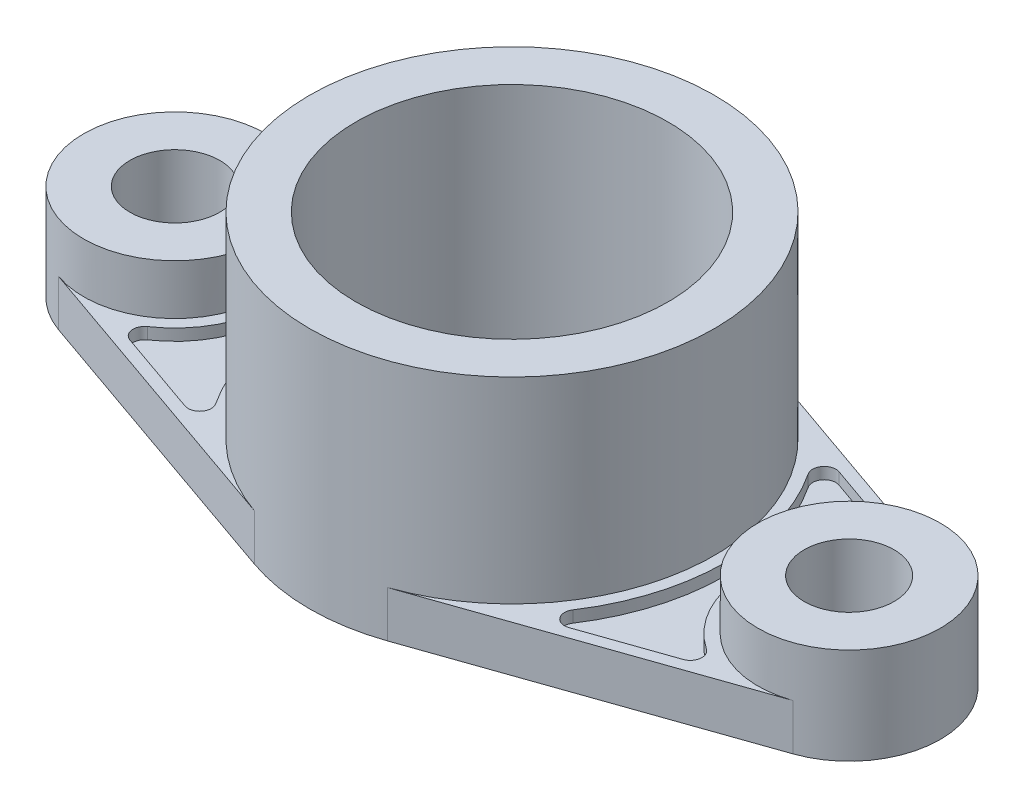
from build123d import *

# Parameters (mm, degrees)
SKETCH1_R             = 23.665
SKETCH1_R_2           = 11.665
BOSS_EXTRUDE1_DEPTH   = 25
BOSS_EXTRUDE1_2_DEPTH = 25
BOSS_EXTRUDE3_DEPTH   = 12
SKETCH1_5_R           = 40.5
BOSS_EXTRUDE4_DEPTH   = 63
CUT_EXTRUDE1_DEPTH    = 3


with BuildPart() as part:
    # Sketch1 → Boss-Extrude1 (new body)
    with BuildSketch(Plane(origin=(0, 0, 0), x_dir=(1, 0, 0), z_dir=(0, 1, 0))):
        with Locations((-87.5, 0)):
            Circle(SKETCH1_R)
        with Locations((-87.5, 0)):
            Circle(SKETCH1_R_2, mode=Mode.SUBTRACT)
    extrude(amount=BOSS_EXTRUDE1_DEPTH)



with BuildPart() as body_2:
    # Sketch1 → Boss-Extrude1 2 (new body)
    with BuildSketch(Plane(origin=(0, 0, 0), x_dir=(1, 0, 0), z_dir=(0, 1, 0))):
        with Locations((87.5, 0)):
            Circle(SKETCH1_R)
        with Locations((87.5, 0)):
            Circle(SKETCH1_R_2, mode=Mode.SUBTRACT)
    extrude(amount=BOSS_EXTRUDE1_2_DEPTH)


with BuildPart() as part_1:
    add(part.part)

    add(body_2.part)  # Boss-Extrude3 merges body 2
    # Sketch1<4> → Boss-Extrude3 (add)
    with BuildSketch(Plane(origin=(0, 0, 0), x_dir=(1, 0, 0), z_dir=(0, 1, 0))):
        with BuildLine():
            Line((-17.301, 49.56738241), (-95.298631714, 22.343087709))
            ThreePointArc((-95.298631714, 22.343087709), (-63.835, 0), (-95.298631714, -22.343087709))
            Line((-95.298631714, -22.343087709), (-17.301, -49.56738241))
            ThreePointArc((-17.301, -49.56738241), (-52.5, 0), (-17.301, 49.56738241))
        make_face()
        with BuildLine():
            Line((95.298631714, 22.343087709), (17.301, 49.56738241))
            ThreePointArc((17.301, 49.56738241), (52.5, 0), (17.301, -49.56738241))
            Line((17.301, -49.56738241), (95.298631714, -22.343087709))
            ThreePointArc((95.298631714, -22.343087709), (63.835, 0), (95.298631714, 22.343087709))
        make_face()
    extrude(amount=BOSS_EXTRUDE3_DEPTH)

    # Sketch1<5> → Boss-Extrude4 (add)
    with BuildSketch(Plane(origin=(0, 0, 0), x_dir=(1, 0, 0), z_dir=(0, 1, 0))):
        with BuildLine():
            ThreePointArc((17.301, 49.56738241), (0, 52.5), (-17.301, 49.56738241))
            ThreePointArc((-17.301, 49.56738241), (-52.5, 0), (-17.301, -49.56738241))
            ThreePointArc((-17.301, -49.56738241), (0, -52.5), (17.301, -49.56738241))
            ThreePointArc((17.301, -49.56738241), (42.805096075, -30.396936523), (52.5, 0))
            ThreePointArc((52.5, 0), (42.805096075, 30.396936523), (17.301, 49.56738241))
        make_face()
        Circle(SKETCH1_5_R, mode=Mode.SUBTRACT)
    extrude(amount=BOSS_EXTRUDE4_DEPTH)

    # Sketch3 → Cut-Extrude1 (cut)
    with BuildSketch(Plane(origin=(0, 12, 0), x_dir=(1, 0, 0), z_dir=(0, 1, 0))):
        with BuildLine():
            Line((-49.82603874, 35.037349549), (-71.809327621, 27.364302024))
            ThreePointArc((-71.809327621, 27.364302024), (-73.795133067, 24.922702734), (-72.507464694, 22.050988869))
            ThreePointArc((-72.507464694, 22.050988869), (-60.835, 0), (-72.507464694, -22.050988869))
            ThreePointArc((-72.507464694, -22.050988869), (-73.795133067, -24.922702734), (-71.809327621, -27.364302024))
            Line((-71.809327621, -27.364302024), (-49.82603874, -35.037349549))
            ThreePointArc((-49.82603874, -35.037349549), (-46.470783868, -34.048587089), (-46.332927596, -30.553392944))
            ThreePointArc((-46.332927596, -30.553392944), (-55.5, 0), (-46.332927596, 30.553392944))
            ThreePointArc((-46.332927596, 30.553392944), (-46.470783868, 34.048587089), (-49.82603874, 35.037349549))
        make_face()
    cut_extrude1 = extrude(amount=-CUT_EXTRUDE1_DEPTH, mode=Mode.SUBTRACT)

    # Mirror1: Cut-Extrude1 across plane
    add(cut_extrude1.mirror(Plane(origin=(0, 0, 0), x_dir=(0, 0, 1), z_dir=(1, 0, 0))), mode=Mode.SUBTRACT)


solid = part_1.part
